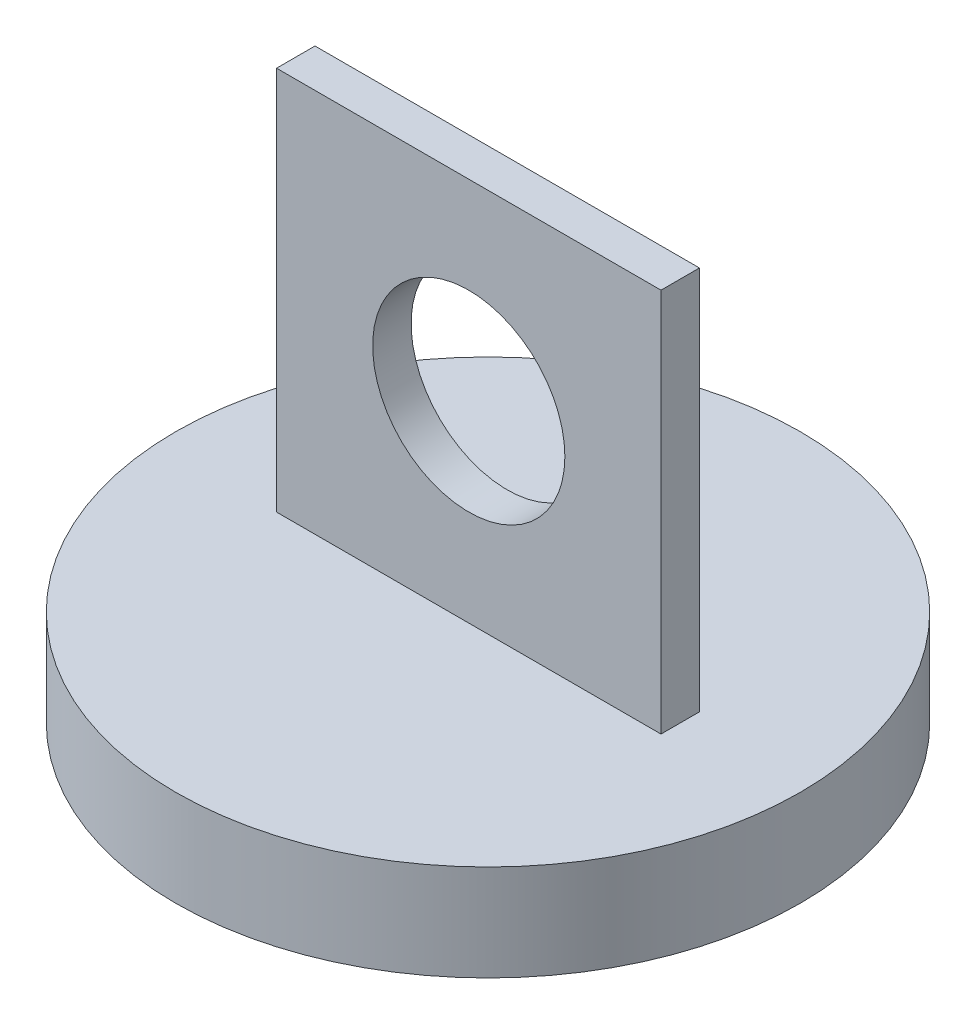
from build123d import *

# Parameters (mm, degrees)
SKETCH1_R           = 32.5
BOSS_EXTRUDE1_DEPTH = 10
SKETCH4_W           = 40
SKETCH4_H           = 4
BOSS_EXTRUDE3_DEPTH = 40
SKETCH5_R           = 10
CUT_EXTRUDE2_DEPTH  = 40


with BuildPart() as part:
    # Sketch1 → Boss-Extrude1 (new body)
    with BuildSketch(Plane(origin=(0, 0, 0), x_dir=(1, 0, 0), z_dir=(0, 1, 0))):
        with Locations(Location((0, 0, 0), (0, 0, 270))):
            Circle(SKETCH1_R)
    extrude(amount=BOSS_EXTRUDE1_DEPTH)

    # Sketch4 → Boss-Extrude3 (add)
    with BuildSketch(Plane(origin=(0, 10, 0), x_dir=(1, 0, 0), z_dir=(0, 1, 0))):
        Rectangle(SKETCH4_W, SKETCH4_H)
    extrude(amount=BOSS_EXTRUDE3_DEPTH)

    # Sketch5 → Cut-Extrude2 (cut)
    with BuildSketch(Plane.XY.offset(2)):
        with Locations((0, 30)):
            Circle(SKETCH5_R)
    extrude(amount=-CUT_EXTRUDE2_DEPTH, mode=Mode.SUBTRACT)


solid = part.part
